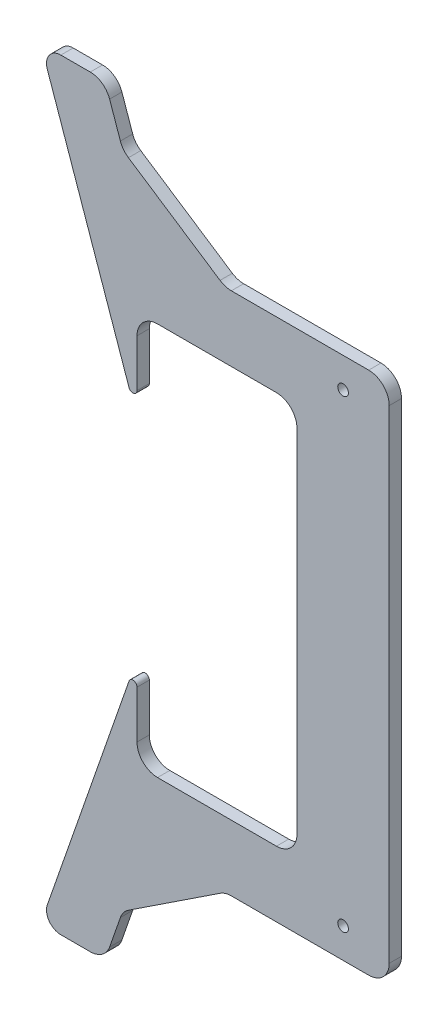
from build123d import *

# Parameters (mm, degrees)
ESBO_O1_R                = 2.6
RESSALTO_EXTRUS_O1_DEPTH = 6
FILETE1_R                = 2
FILETE3_R                = 10
FILETE4_R                = 7


with BuildPart() as part:
    # Esboço1 → Ressalto-extrusão1 (new body)
    with BuildSketch(Plane.XY):
        Polygon((-100.5, 95.8), (-22.5, 95.8), (-22.5, -95.8), (-100.5, -95.8), (-100.5, -50.8), (-147.5, -185.8), (-116.203703704, -185.8), (-107.5, -160.8), (-57.5, -127.8), (22.5, -127.8), (22.5, 127.8), (-57.5, 127.8), (-107.5, 160.8), (-116.203703704, 185.8), (-147.5, 185.8), (-100.5, 50.8), align=None)
        with Locations((0, 113.2)):
            Circle(ESBO_O1_R, mode=Mode.SUBTRACT)
        with Locations((0, -113.2)):
            Circle(ESBO_O1_R, mode=Mode.SUBTRACT)
    extrude(amount=RESSALTO_EXTRUS_O1_DEPTH)

    # Filete1
    filete1_edges = [part.edges().sort_by_distance(p)[0] for p in [
        (-100.5, -50.8, 3),
        (-100.5, 50.8, 3),
    ]]
    fillet(filete1_edges, radius=FILETE1_R)

    # Filete3
    filete3_edges = [part.edges().sort_by_distance(p)[0] for p in [
        (-57.5, 127.8, 3),
        (22.5, 127.8, 3),
        (22.5, -127.8, 3),
        (-57.5, -127.8, 3),
        (-107.5, -160.8, 3),
        (-116.203703704, -185.8, 3),
        (-100.5, -95.8, 3),
        (-22.5, -95.8, 3),
        (-22.5, 95.8, 3),
        (-100.5, 95.8, 3),
        (-116.203703704, 185.8, 3),
        (-107.5, 160.8, 3),
    ]]
    fillet(filete3_edges, radius=FILETE3_R)

    # Filete4
    filete4_edges = [part.edges().sort_by_distance(p)[0] for p in [
        (-147.5, -185.8, 3),
        (-147.5, 185.8, 3),
    ]]
    fillet(filete4_edges, radius=FILETE4_R)


solid = part.part
